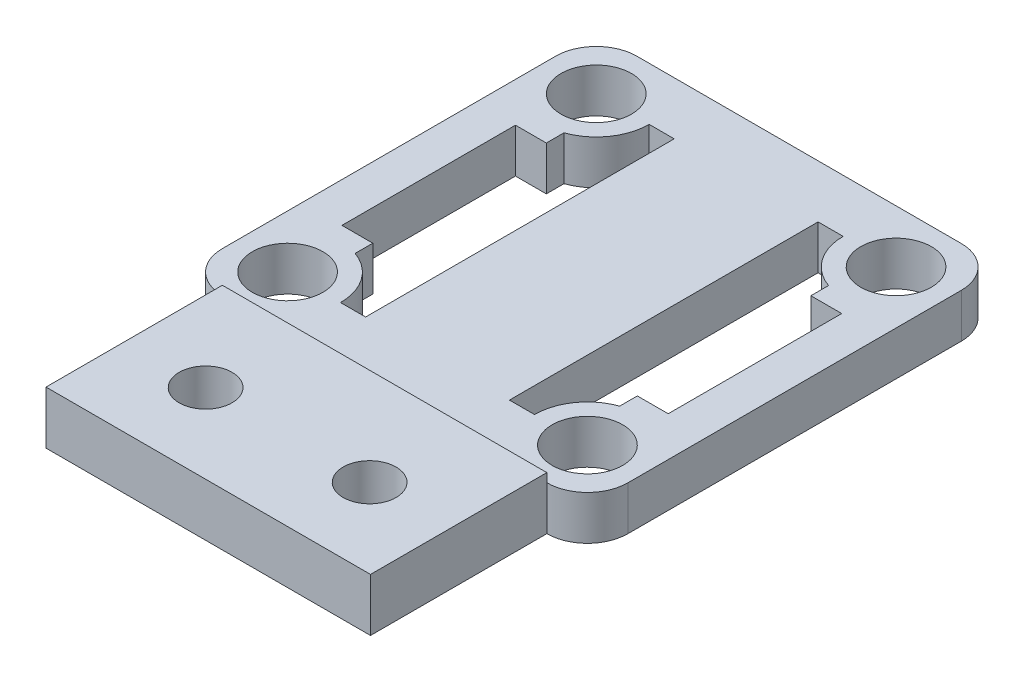
from build123d import *

# Parameters (mm, degrees)
BOSS_EXTRUDE1_DEPTH      = 2
CUT_EXTRUDE2_DEPTH       = 1
SKETCH5_R                = 2
CUT_EXTRUDE3_DEPTH       = 21.942838525
CUT_EXTRUDE4_DEPTH       = 21.942838525
SKETCH7_W                = 18.4
SKETCH7_H                = 1
BOSS_EXTRUDE2_DEPTH      = 10
CUT_EXTRUDE6_DEPTH       = 1
SKETCH11_W               = 1.421057218
SKETCH11_H               = 17.5
SKETCH11_W_2             = 1.75
SKETCH11_H_2             = 9.84
CUT_EXTRUDE7_DEPTH       = 25.092211634
BOSS_EXTRUDE3_START      = 2
BOSS_EXTRUDE3_DEPTH      = 2
CUT_EXTRUDE8_DEPTH       = 25.154392176
CUT_EXTRUDE8_DEPTH_BACK  = 25.154392176
CUT_EXTRUDE9_DEPTH       = 25.154392176
CUT_EXTRUDE9_DEPTH_BACK  = 25.154392176
CUT_EXTRUDE12_DEPTH      = 25.154392176
CUT_EXTRUDE12_DEPTH_BACK = 25.154392176
SKETCH17_R               = 2
BOSS_EXTRUDE4_START      = 1
BOSS_EXTRUDE4_DEPTH      = 1
CUT_EXTRUDE13_DEPTH      = 25.257672217
CUT_EXTRUDE13_DEPTH_BACK = 25.257672217
SKETCH19_R               = 2
CUT_EXTRUDE14_START      = -1.5
CUT_EXTRUDE14_DEPTH      = 1.5
SKETCH22_R               = 1.5
CUT_EXTRUDE17_DEPTH      = 10


with BuildPart() as part:
    # Sketch1 → Boss-Extrude1 (new body)
    with BuildSketch(Plane(origin=(0, 0, 0), x_dir=(1, 0, 0), z_dir=(0, 1, 0))):
        with BuildLine():
            Line((-12.649074074, 14.633101852), (5.750925926, 14.633101852))
            ThreePointArc((5.750925926, 14.633101852), (7.377271523, 13.959447449), (8.050925926, 12.333101852))
            Line((8.050925926, 12.333101852), (8.050925926, -6.566898148))
            ThreePointArc((8.050925926, -6.566898148), (7.377271523, -8.193243745), (5.750925926, -8.866898148))
            Line((5.750925926, -8.866898148), (-12.649074074, -8.866898148))
            ThreePointArc((-12.649074074, -8.866898148), (-14.275419671, -8.193243745), (-14.949074074, -6.566898148))
            Line((-14.949074074, -6.566898148), (-14.949074074, 12.333101852))
            ThreePointArc((-14.949074074, 12.333101852), (-14.275419671, 13.959447449), (-12.649074074, 14.633101852))
        make_face()
    extrude(amount=BOSS_EXTRUDE1_DEPTH)

    # Sketch2 → Cut-Extrude2 (cut)
    with BuildSketch(Plane(origin=(0, 2, 0), x_dir=(1, 0, 0), z_dir=(0, 1, 0))):
        with BuildLine():
            Line((5.750925926, 13.633101852), (-12.649074074, 13.633101852))
            ThreePointArc((-12.649074074, 13.633101852), (-13.56831289, 13.252340667), (-13.949074074, 12.333101852))
            Line((-13.949074074, 12.333101852), (-13.949074074, -6.566898148))
            ThreePointArc((-13.949074074, -6.566898148), (-13.56831289, -7.486136964), (-12.649074074, -7.866898148))
            Line((-12.649074074, -7.866898148), (5.750925926, -7.866898148))
            ThreePointArc((5.750925926, -7.866898148), (6.670164741, -7.486136964), (7.050925926, -6.566898148))
            Line((7.050925926, -6.566898148), (7.050925926, 12.333101852))
            ThreePointArc((7.050925926, 12.333101852), (6.670164741, 13.252340667), (5.750925926, 13.633101852))
        make_face()
    extrude(amount=-CUT_EXTRUDE2_DEPTH, mode=Mode.SUBTRACT)

    # Sketch5 → Cut-Extrude3 (cut, through all)
    with BuildSketch(Plane(origin=(0, 1, 0), x_dir=(1, 0, 0), z_dir=(0, 1, 0))):
        with Locations(Location((5.050925926, 11.633101852, 0), (0, 0, 270))):
            Circle(SKETCH5_R)
        with Locations(Location((5.050925926, -5.866898148, 0), (0, 0, 270))):
            Circle(SKETCH5_R)
        with Locations(Location((-11.949074074, -5.866898148, 0), (0, 0, 270))):
            Circle(SKETCH5_R)
        with Locations(Location((-11.949074074, 11.633101852, 0), (0, 0, 90))):
            Circle(SKETCH5_R)
    extrude(amount=-CUT_EXTRUDE3_DEPTH, mode=Mode.SUBTRACT)

    # Sketch6 → Cut-Extrude4 (cut, through all)
    with BuildSketch(Plane(origin=(0, 1, 0), x_dir=(1, 0, 0), z_dir=(0, 1, 0))):
        with BuildLine():
            Line((4.050925926, -3.038471023), (4.050925926, 8.804674727))
            ThreePointArc((4.050925926, 8.804674727), (2.601436183, 9.901051044), (2.050925926, 11.633101852))
            Line((2.050925926, 11.633101852), (2.050925926, -5.866898148))
            ThreePointArc((2.050925926, -5.866898148), (2.601436183, -4.134847341), (4.050925926, -3.038471023))
        make_face()
        with BuildLine():
            Line((-10.949074074, 8.804674727), (-10.949074074, -3.038471023))
            ThreePointArc((-10.949074074, -3.038471023), (-9.499584331, -4.134847341), (-8.949074074, -5.866898148))
            Line((-8.949074074, -5.866898148), (-8.949074074, 11.633101852))
            ThreePointArc((-8.949074074, 11.633101852), (-9.499584331, 9.901051044), (-10.949074074, 8.804674727))
        make_face()
    extrude(amount=-CUT_EXTRUDE4_DEPTH, mode=Mode.SUBTRACT)

    # Sketch7 → Boss-Extrude2 (add)
    with BuildSketch(Plane.XY.offset(8.866898148)):
        with Locations((-3.449074074, 0.5)):
            Rectangle(SKETCH7_W, SKETCH7_H)
    extrude(amount=BOSS_EXTRUDE2_DEPTH)

    # Sketch9 → Cut-Extrude6 (cut)
    with BuildSketch(Plane(origin=(0, 2, 0), x_dir=(1, 0, 0), z_dir=(0, 1, 0))):
        with BuildLine():
            Line((5.750925926, 13.833101852), (-12.649074074, 13.833101852))
            ThreePointArc((-12.649074074, 13.833101852), (-13.709734246, 13.393762024), (-14.149074074, 12.333101852))
            Line((-14.149074074, 12.333101852), (-14.149074074, -6.566898148))
            ThreePointArc((-14.149074074, -6.566898148), (-13.709734246, -7.62755832), (-12.649074074, -8.066898148))
            Line((-12.649074074, -8.066898148), (5.750925926, -8.066898148))
            ThreePointArc((5.750925926, -8.066898148), (6.811586098, -7.62755832), (7.250925926, -6.566898148))
            Line((7.250925926, -6.566898148), (7.250925926, 12.333101852))
            ThreePointArc((7.250925926, 12.333101852), (6.811586098, 13.393762024), (5.750925926, 13.833101852))
        make_face()
    extrude(amount=-CUT_EXTRUDE6_DEPTH, mode=Mode.SUBTRACT)

    # Sketch11 → Cut-Extrude7 (cut, through all)
    with BuildSketch(Plane(origin=(0, 1, 0), x_dir=(1, 0, 0), z_dir=(0, 1, 0))):
        with Locations((-8.238545465, 2.883101852)):
            Rectangle(SKETCH11_W, SKETCH11_H)
        with Locations((1.340397317, 2.883101852)):
            Rectangle(SKETCH11_W, SKETCH11_H)
        with Locations((-11.824074074, 2.883101852)):
            Rectangle(SKETCH11_W_2, SKETCH11_H_2)
        with Locations((4.925925926, 2.883101852)):
            Rectangle(SKETCH11_W_2, SKETCH11_H_2)
    extrude(amount=-CUT_EXTRUDE7_DEPTH, mode=Mode.SUBTRACT)

    # Sketch12 → Boss-Extrude3 (add)
    with BuildSketch(Plane.XZ.offset(BOSS_EXTRUDE3_START)):
        with BuildLine():
            Line((8.050925926, -12.333101852), (8.050925926, 6.566898148))
            ThreePointArc((8.050925926, 6.566898148), (7.377271523, 8.193243745), (5.750925926, 8.866898148))
            Line((5.750925926, 8.866898148), (5.750925926, 18.866898148))
            Line((5.750925926, 18.866898148), (-12.649074074, 18.866898148))
            Line((-12.649074074, 18.866898148), (-12.649074074, 8.866898148))
            ThreePointArc((-12.649074074, 8.866898148), (-14.275419671, 8.193243745), (-14.949074074, 6.566898148))
            Line((-14.949074074, 6.566898148), (-14.949074074, -12.333101852))
            ThreePointArc((-14.949074074, -12.333101852), (-14.275419671, -13.959447449), (-12.649074074, -14.633101852))
            Line((-12.649074074, -14.633101852), (5.750925926, -14.633101852))
            ThreePointArc((5.750925926, -14.633101852), (7.377271523, -13.959447449), (8.050925926, -12.333101852))
        make_face()
    extrude(amount=-BOSS_EXTRUDE3_DEPTH)

    # Sketch13 → Cut-Extrude8 (cut, two sides: drawn at the far end of the back side and taken through both)
    with BuildSketch(Plane(origin=(0, 0, 0), x_dir=(1, 0, 0), z_dir=(0, 1, 0)).offset(-CUT_EXTRUDE8_DEPTH_BACK)):
        with BuildLine():
            Line((-12.699074074, 7.803101852), (-12.699074074, -2.036898148))
            Line((-12.699074074, -2.036898148), (-10.949074074, -2.036898148))
            Line((-10.949074074, -2.036898148), (-10.949074074, -3.038471023))
            ThreePointArc((-10.949074074, -3.038471023), (-9.499584331, -4.134847341), (-8.949074074, -5.866898148))
            Line((-8.949074074, -5.866898148), (-7.528016856, -5.866898148))
            Line((-7.528016856, -5.866898148), (-7.528016856, 11.633101852))
            Line((-7.528016856, 11.633101852), (-8.949074074, 11.633101852))
            ThreePointArc((-8.949074074, 11.633101852), (-9.499584331, 9.901051044), (-10.949074074, 8.804674727))
            Line((-10.949074074, 8.804674727), (-10.949074074, 7.803101852))
            Line((-10.949074074, 7.803101852), (-12.699074074, 7.803101852))
        make_face()
    extrude(amount=CUT_EXTRUDE8_DEPTH + CUT_EXTRUDE8_DEPTH_BACK, mode=Mode.SUBTRACT)

    # Sketch14 → Cut-Extrude9 (cut, two sides: drawn at the far end of the back side and taken through both)
    with BuildSketch(Plane(origin=(0, 0, 0), x_dir=(1, 0, 0), z_dir=(0, 1, 0)).offset(-CUT_EXTRUDE9_DEPTH_BACK)):
        with BuildLine():
            Line((0.629868708, -5.866898148), (2.050925926, -5.866898148))
            ThreePointArc((2.050925926, -5.866898148), (2.601436183, -4.134847341), (4.050925926, -3.038471023))
            Line((4.050925926, -3.038471023), (4.050925926, -2.036898148))
            Line((4.050925926, -2.036898148), (5.800925926, -2.036898148))
            Line((5.800925926, -2.036898148), (5.800925926, 7.803101852))
            Line((5.800925926, 7.803101852), (4.050925926, 7.803101852))
            Line((4.050925926, 7.803101852), (4.050925926, 8.804674727))
            ThreePointArc((4.050925926, 8.804674727), (2.601436183, 9.901051044), (2.050925926, 11.633101852))
            Line((2.050925926, 11.633101852), (0.629868708, 11.633101852))
            Line((0.629868708, 11.633101852), (0.629868708, -5.866898148))
        make_face()
    extrude(amount=CUT_EXTRUDE9_DEPTH + CUT_EXTRUDE9_DEPTH_BACK, mode=Mode.SUBTRACT)

    # Sketch17 → Cut-Extrude12 (cut, two sides: drawn at the far end of the back side and taken through both)
    with BuildSketch(Plane(origin=(0, 0, 0), x_dir=(1, 0, 0), z_dir=(0, 1, 0)).offset(-CUT_EXTRUDE12_DEPTH_BACK)):
        with Locations(Location((-11.949074074, -5.866898148, 0), (0, 0, 270))):
            Circle(SKETCH17_R)
        with Locations(Location((5.050925926, -5.866898148, 0), (0, 0, 270))):
            Circle(SKETCH17_R)
        with Locations(Location((-11.949074074, 11.633101852, 0), (0, 0, 270))):
            Circle(SKETCH17_R)
        with Locations(Location((5.050925926, 11.633101852, 0), (0, 0, 270))):
            Circle(SKETCH17_R)
    extrude(amount=CUT_EXTRUDE12_DEPTH + CUT_EXTRUDE12_DEPTH_BACK, mode=Mode.SUBTRACT)

    # Sketch18 → Boss-Extrude4 (add)
    with BuildSketch(Plane(origin=(0, 1, 0), x_dir=(1, 0, 0), z_dir=(0, 1, 0)).offset(BOSS_EXTRUDE4_START)):
        with BuildLine():
            Line((5.750925926, 13.833101852), (-12.649074074, 13.833101852))
            ThreePointArc((-12.649074074, 13.833101852), (-13.709734246, 13.393762024), (-14.149074074, 12.333101852))
            Line((-14.149074074, 12.333101852), (-14.149074074, -6.566898148))
            ThreePointArc((-14.149074074, -6.566898148), (-13.709734246, -7.62755832), (-12.649074074, -8.066898148))
            Line((-12.649074074, -8.066898148), (5.750925926, -8.066898148))
            ThreePointArc((5.750925926, -8.066898148), (6.811586098, -7.62755832), (7.250925926, -6.566898148))
            Line((7.250925926, -6.566898148), (7.250925926, 12.333101852))
            ThreePointArc((7.250925926, 12.333101852), (6.811586098, 13.393762024), (5.750925926, 13.833101852))
        make_face()
    extrude(amount=-BOSS_EXTRUDE4_DEPTH)

    # Sketch19 → Cut-Extrude13 (cut, two sides: drawn at the far end of the back side and taken through both)
    with BuildSketch(Plane.XZ.offset(-1).offset(-CUT_EXTRUDE13_DEPTH_BACK)):
        with Locations(Location((5.050925926, -11.633101852, 0), (0, 0, 90))):
            Circle(SKETCH19_R)
        with Locations(Location((-11.949074074, -11.633101852, 0), (0, 0, 90))):
            Circle(SKETCH19_R)
        with Locations(Location((-11.949074074, 5.866898148, 0), (0, 0, 90))):
            Circle(SKETCH19_R)
        with Locations(Location((5.050925926, 5.866898148, 0), (0, 0, 90))):
            Circle(SKETCH19_R)
        with BuildLine():
            Line((-10.949074074, 3.038471023), (-10.949074074, 2.036898148))
            Line((-10.949074074, 2.036898148), (-12.699074074, 2.036898148))
            Line((-12.699074074, 2.036898148), (-12.699074074, -7.803101852))
            Line((-12.699074074, -7.803101852), (-10.949074074, -7.803101852))
            Line((-10.949074074, -7.803101852), (-10.949074074, -8.804674727))
            ThreePointArc((-10.949074074, -8.804674727), (-9.499584331, -9.901051044), (-8.949074074, -11.633101852))
            Line((-8.949074074, -11.633101852), (-7.528016856, -11.633101852))
            Line((-7.528016856, -11.633101852), (-7.528016856, 5.866898148))
            Line((-7.528016856, 5.866898148), (-8.949074074, 5.866898148))
            ThreePointArc((-8.949074074, 5.866898148), (-9.499584331, 4.134847341), (-10.949074074, 3.038471023))
        make_face()
        with BuildLine():
            Line((4.050925926, 2.036898148), (4.050925926, 3.038471023))
            ThreePointArc((4.050925926, 3.038471023), (2.601436183, 4.134847341), (2.050925926, 5.866898148))
            Line((2.050925926, 5.866898148), (0.629868708, 5.866898148))
            Line((0.629868708, 5.866898148), (0.629868708, -11.633101852))
            Line((0.629868708, -11.633101852), (2.050925926, -11.633101852))
            ThreePointArc((2.050925926, -11.633101852), (2.601436183, -9.901051044), (4.050925926, -8.804674727))
            Line((4.050925926, -8.804674727), (4.050925926, -7.803101852))
            Line((4.050925926, -7.803101852), (5.800925926, -7.803101852))
            Line((5.800925926, -7.803101852), (5.800925926, 2.036898148))
            Line((5.800925926, 2.036898148), (4.050925926, 2.036898148))
        make_face()
    extrude(amount=CUT_EXTRUDE13_DEPTH + CUT_EXTRUDE13_DEPTH_BACK, mode=Mode.SUBTRACT)

    # Sketch20 → Cut-Extrude14 (cut)
    with BuildSketch(Plane(origin=(0, 2, 0), x_dir=(1, 0, 0), z_dir=(0, 1, 0)).offset(CUT_EXTRUDE14_START)):
        with BuildLine():
            Line((5.750925926, 14.633101852), (-12.649074074, 14.633101852))
            ThreePointArc((-12.649074074, 14.633101852), (-14.275419671, 13.959447449), (-14.949074074, 12.333101852))
            Line((-14.949074074, 12.333101852), (-14.949074074, -6.566898148))
            ThreePointArc((-14.949074074, -6.566898148), (-14.275419671, -8.193243745), (-12.649074074, -8.866898148))
            Line((-12.649074074, -8.866898148), (5.750925926, -8.866898148))
            ThreePointArc((5.750925926, -8.866898148), (7.377271523, -8.193243745), (8.050925926, -6.566898148))
            Line((8.050925926, -6.566898148), (8.050925926, 12.333101852))
            ThreePointArc((8.050925926, 12.333101852), (7.377271523, 13.959447449), (5.750925926, 14.633101852))
        make_face()
    extrude(amount=CUT_EXTRUDE14_DEPTH, mode=Mode.SUBTRACT)

    # Sketch22 → Cut-Extrude17 (cut)
    with BuildSketch(Plane(origin=(0, 1, 0), x_dir=(1, 0, 0), z_dir=(0, 1, 0))):
        with Locations(Location((-8.099074074, -14.366898148, 0), (0, 0, 270))):
            Circle(SKETCH22_R)
        with Locations(Location((1.200925926, -14.366898148, 0), (0, 0, 270))):
            Circle(SKETCH22_R)
    extrude(amount=-CUT_EXTRUDE17_DEPTH, mode=Mode.SUBTRACT)


solid = part.part
